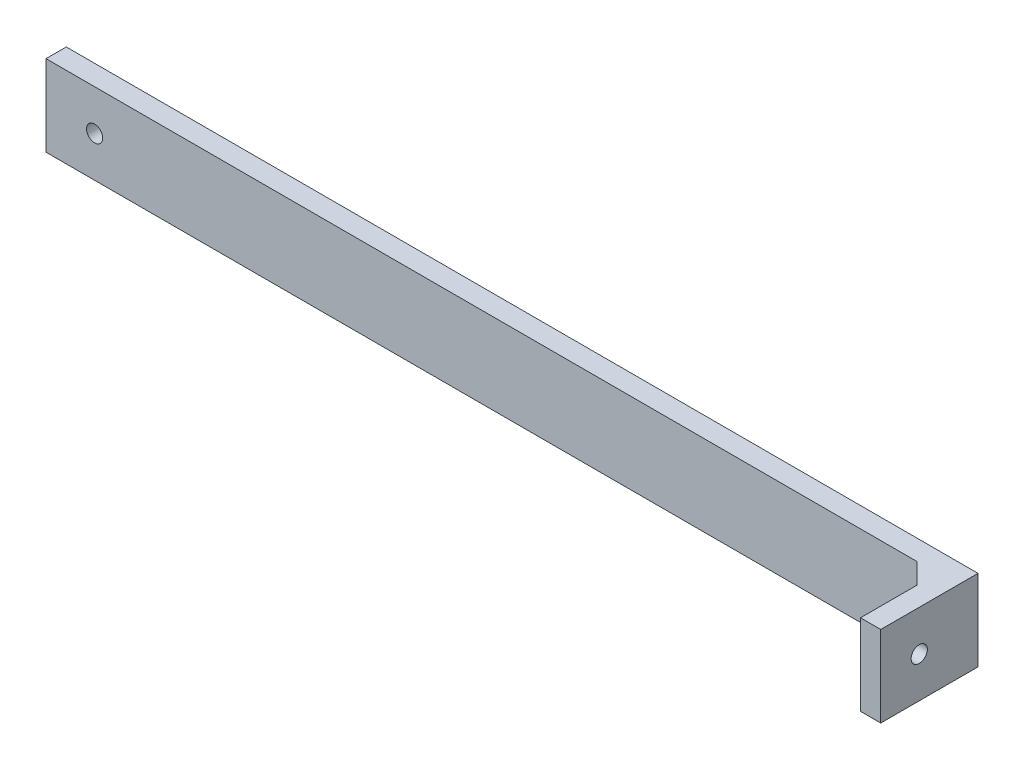
from build123d import *

# Parameters (mm, degrees)
SKETCH1_W           = 225
SKETCH1_H           = 20
BOSS_EXTRUDE1_DEPTH = 5
SKETCH2_W           = 5
SKETCH2_H           = 20
BOSS_EXTRUDE2_DEPTH = 19
SKETCH3_R           = 2
CUT_EXTRUDE1_DEPTH  = 227.497240601
SKETCH4_W           = 5
SKETCH4_H           = 5
BOSS_EXTRUDE3_DEPTH = 5
CUT_EXTRUDE2_DEPTH  = 117.757226757
SKETCH6_R           = 2
CUT_EXTRUDE3_DEPTH  = 116.465362772


with BuildPart() as part:
    # Sketch1 → Boss-Extrude1 (new body)
    with BuildSketch(Plane.XY):
        Rectangle(SKETCH1_W, SKETCH1_H)
    extrude(amount=BOSS_EXTRUDE1_DEPTH)

    # Sketch2 → Boss-Extrude2 (add)
    with BuildSketch(Plane.XY.offset(5)):
        with Locations((110, 0)):
            Rectangle(SKETCH2_W, SKETCH2_H)
    extrude(amount=BOSS_EXTRUDE2_DEPTH)

    # Sketch3 → Cut-Extrude1 (cut, through all)
    with BuildSketch(Plane(origin=(112.5, 0, 0), x_dir=(0, 0, -1), z_dir=(1, 0, 0))):
        with Locations((-14.5, 0)):
            Circle(SKETCH3_R)
    extrude(amount=-CUT_EXTRUDE1_DEPTH, mode=Mode.SUBTRACT)

    # Sketch4 → Boss-Extrude3 (add)
    with BuildSketch(Plane.ZY.offset(-107.5)):
        with Locations((7.5, -7.5)):
            Rectangle(SKETCH4_W, SKETCH4_H)
        with Locations((7.5, 7.5)):
            Rectangle(SKETCH4_W, SKETCH4_H)
    extrude(amount=BOSS_EXTRUDE3_DEPTH)

    # Sketch5 → Cut-Extrude2 (cut, through all)
    with BuildSketch(Plane.XZ.offset(10)):
        Polygon((102.5, 5), (107.5, 10), (102.5, 10), align=None)
    extrude(amount=-CUT_EXTRUDE2_DEPTH, mode=Mode.SUBTRACT)

    # Sketch6 → Cut-Extrude3 (cut, through all)
    with BuildSketch(Plane(origin=(0, 0, 0), x_dir=(-1, 0, 0), z_dir=(0, 0, -1))):
        with Locations((100.5, 0)):
            Circle(SKETCH6_R)
    extrude(amount=-CUT_EXTRUDE3_DEPTH, mode=Mode.SUBTRACT)


solid = part.part
